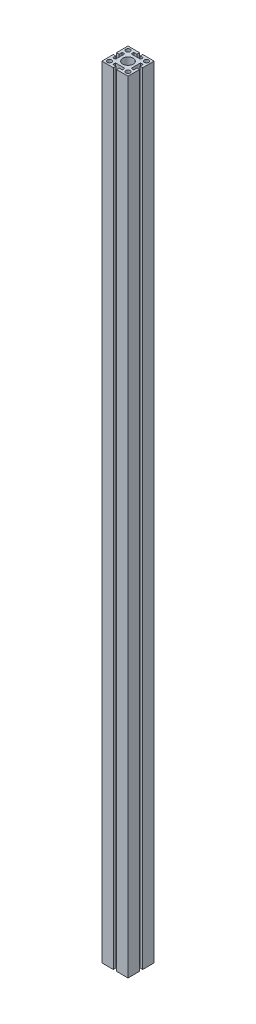
from build123d import *

# Parameters (mm, degrees)
SKETCH1_R           = 10
SKETCH1_R_2         = 4.138691164
BOSS_EXTRUDE1_DEPTH = 1494


with BuildPart() as part:
    # Sketch1 → Boss-Extrude1 (new body)
    with BuildSketch(Plane(origin=(0, 0, 0), x_dir=(1, 0, 0), z_dir=(0, 1, 0))):
        Polygon((-25, -3), (-25, -25), (-3, -25), (-3, -20), (-9, -20), (-9, -15), (9, -15), (9, -20), (3, -20), (3, -25), (25, -25), (25, -3), (20, -3), (20, -9), (15, -9), (15, 9), (20, 9), (20, 3), (25, 3), (25, 25), (3, 25), (3, 20), (9, 20), (9, 15), (-9, 15), (-9, 20), (-3, 20), (-3, 25), (-25, 25), (-25, 3), (-20, 3), (-20, 9), (-15, 9), (-15, -9), (-20, -9), (-20, -3), align=None)
        with Locations(Location((0, 0, 0), (0, 0, 270))):
            Circle(SKETCH1_R, mode=Mode.SUBTRACT)
        with Locations(Location((-17.67766953, 17.67766953, 0), (0, 0, 270))):
            Circle(SKETCH1_R_2, mode=Mode.SUBTRACT)
        with Locations(Location((17.67766953, 17.67766953, 0), (0, 0, 270))):
            Circle(SKETCH1_R_2, mode=Mode.SUBTRACT)
        with Locations(Location((17.67766953, -17.67766953, 0), (0, 0, 270))):
            Circle(SKETCH1_R_2, mode=Mode.SUBTRACT)
        with Locations(Location((-17.67766953, -17.67766953, 0), (0, 0, 270))):
            Circle(SKETCH1_R_2, mode=Mode.SUBTRACT)
    extrude(amount=BOSS_EXTRUDE1_DEPTH)


solid = part.part
